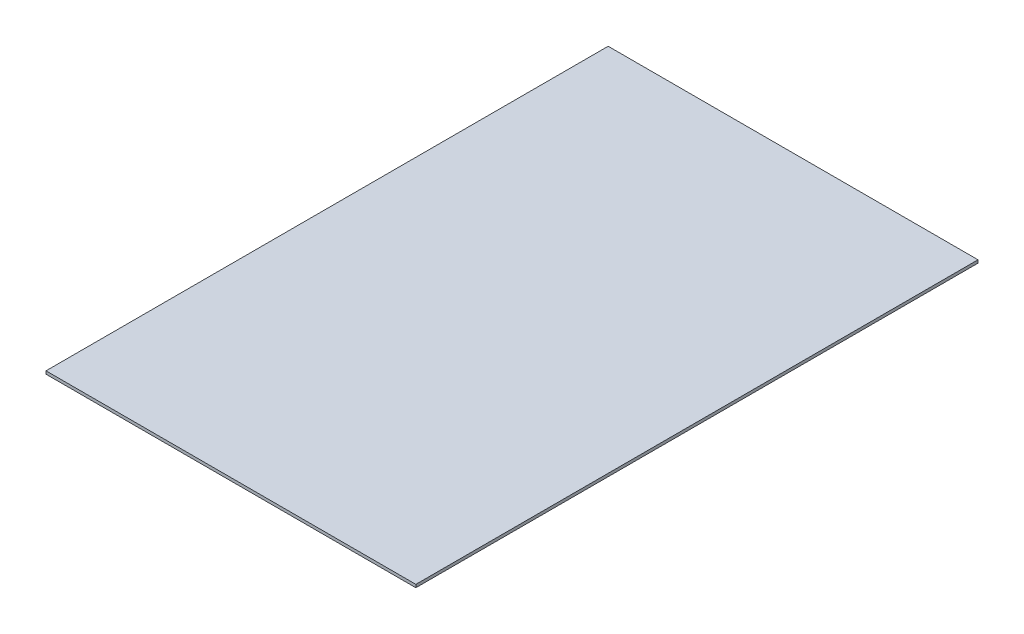
from build123d import *

# Parameters (mm, degrees)
SKETCH1_W           = 317.5
SKETCH1_H           = 482.6
BOSS_EXTRUDE1_DEPTH = 2.54


with BuildPart() as part:
    # Sketch1 → Boss-Extrude1 (new body)
    with BuildSketch(Plane(origin=(0, 0, 0), x_dir=(1, 0, 0), z_dir=(0, 1, 0))):
        Rectangle(SKETCH1_W, SKETCH1_H)
    extrude(amount=BOSS_EXTRUDE1_DEPTH)


solid = part.part
